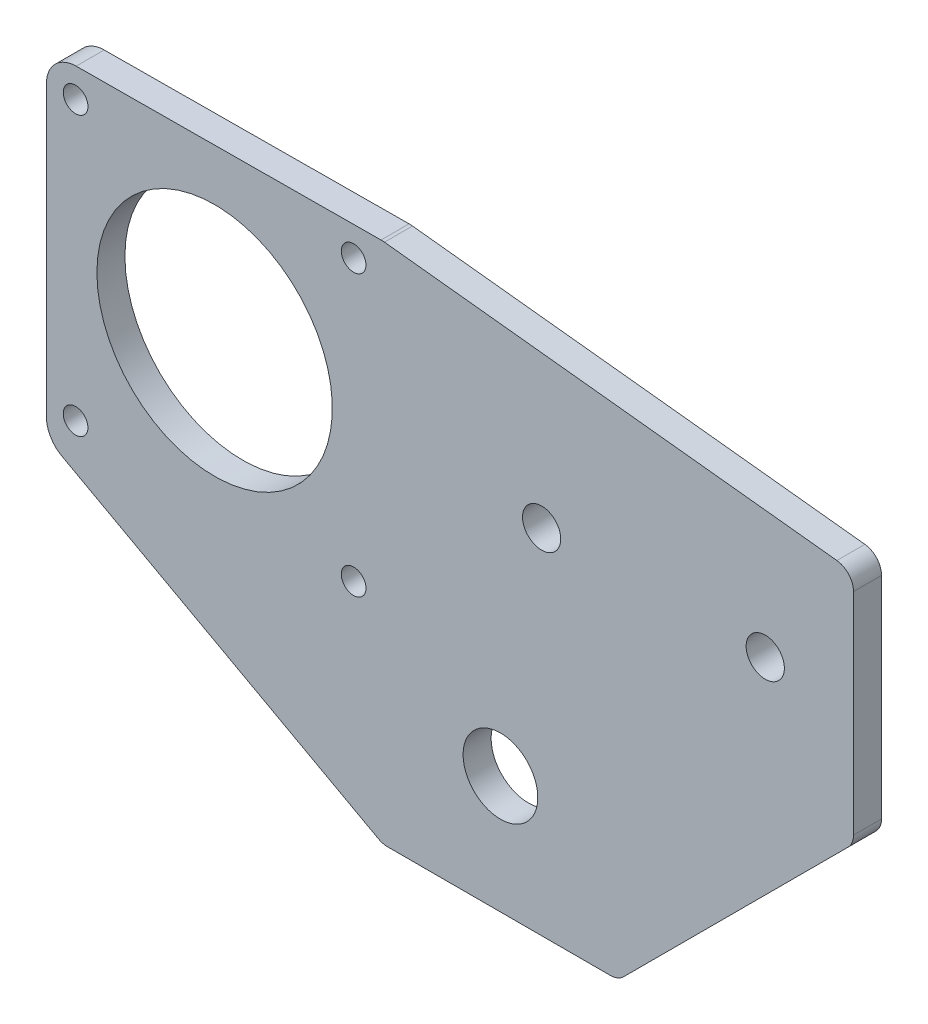
from build123d import *

# Parameters (mm, degrees)
SKETCH3_R             = 6.350000004
SKETCH3_R_2           = 3.25
SKETCH3_R_3           = 20.005589459
BOSS_EXTRUDE1_DEPTH   = 4.7625
FILLET1_R             = 3.175
FILLET2_R             = 5.08
M5_TAPPED_HOLE1_D     = 4.2
M5_TAPPED_HOLE1_DEPTH = 14
M5_TAPPED_HOLE1_TIP   = 1.2618073


with BuildPart() as part:
    # Sketch3 → Boss-Extrude1 (new body)
    with BuildSketch(Plane.XY.offset(-194.177612449)):
        Polygon((-209.572241428, 79.105126535), (-129.572241428, 70.355126535), (-129.572241428, 30.355126535), (-169.572241428, -9.644873465), (-209.572241428, -9.644873465), (-266.721169677, 21.605126535), (-266.721169677, 78.755126535), align=None)
        with Locations(Location((-189.572241428, 10.355126535, 0), (0, 0, 180))):
            Circle(SKETCH3_R, mode=Mode.SUBTRACT)
        with Locations(Location((-182.572241428, 50.355126535, 0), (0, 0, 180))):
            Circle(SKETCH3_R_2, mode=Mode.SUBTRACT)
        with Locations(Location((-144.572241428, 50.355126535, 0), (0, 0, 180))):
            Circle(SKETCH3_R_2, mode=Mode.SUBTRACT)
        with Locations(Location((-238.146169677, 50.180126535, 0), (0, 0, 180))):
            Circle(SKETCH3_R_3, mode=Mode.SUBTRACT)
    extrude(amount=BOSS_EXTRUDE1_DEPTH)

    # Fillet1
    fillet1_edges = [part.edges().sort_by_distance(p)[0] for p in [
        (-209.572241428, -9.644873465, -191.796362449),
        (-169.572241428, -9.644873465, -191.796362449),
        (-129.572241428, 30.355126535, -191.796362449),
        (-129.572241428, 70.355126535, -191.796362449),
    ]]
    fillet(fillet1_edges, radius=FILLET1_R)

    # Fillet2
    fillet2_edges = [part.edges().sort_by_distance(p)[0] for p in [
        (-266.721169677, 78.755126535, -191.796362449),
        (-266.721169677, 21.605126535, -191.796362449),
        (-209.572241428, 79.105126535, -191.796362449),
    ]]
    fillet(fillet2_edges, radius=FILLET2_R)

    # M5 Tapped Hole1
    with Locations(Plane.XY.offset(-189.415112449)):
        with Locations((-214.522241428, 74.124718176), (-261.771169677, 73.835349234), (-214.522241428, 26.555126535), (-261.771169677, 26.555126535)):
            Hole(M5_TAPPED_HOLE1_D / 2, depth=M5_TAPPED_HOLE1_DEPTH)
            with Locations((0, 0, -(M5_TAPPED_HOLE1_DEPTH + M5_TAPPED_HOLE1_TIP / 2))):  # 118° drill point
                Cone(0, M5_TAPPED_HOLE1_D / 2, M5_TAPPED_HOLE1_TIP, mode=Mode.SUBTRACT)


solid = part.part
